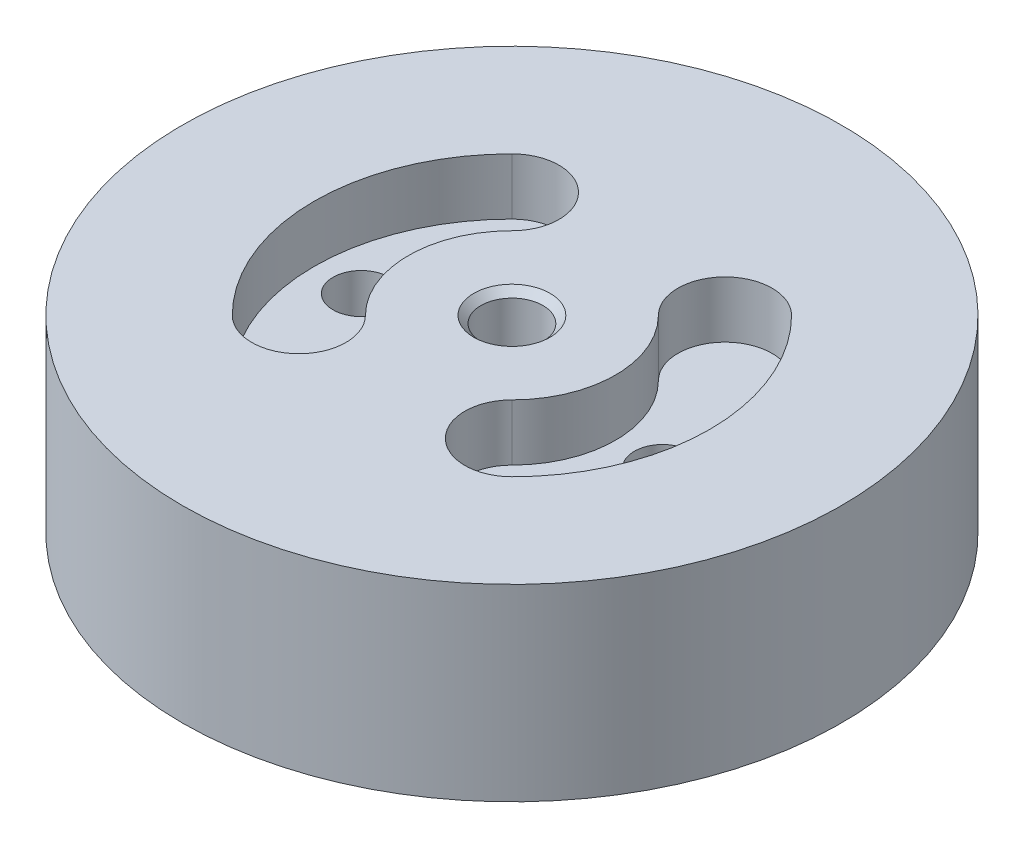
from build123d import *

# Parameters (mm, degrees)
IZIM1_R                     = 17.5
Y_KSEKLIK_EKSTR_ZYON1_DEPTH = 10
KES_EKSTR_ZYON1_DEPTH       = 3
M4_DI_LI_DELIK1_D           = 3.3
M4_DI_LI_DELIK1_DEPTH       = 8
M4_DI_LI_DELIK1_CSINK_D     = 4.05
M4_DI_LI_DELIK1_CSINK_ANGLE = 90
M4_DI_LI_DELIK1_TIP         = 0.991420021
M4_DI_LI_DELIK2_D           = 3.3
M4_DI_LI_DELIK2_CSINK_D     = 4.05
M4_DI_LI_DELIK2_CSINK_ANGLE = 90
IZIM10_R                    = 1.5
KES_EKSTR_ZYON3_DEPTH       = 26.719642299


with BuildPart() as part:
    # Çizim1 → Yükseklik-Ekstrüzyon1 (new body)
    with BuildSketch(Plane(origin=(0, 0, 0), x_dir=(1, 0, 0), z_dir=(0, 1, 0))):
        with Locations(Location((0, 0, 0), (0, 0, 270))):
            Circle(IZIM1_R)
    extrude(amount=Y_KSEKLIK_EKSTR_ZYON1_DEPTH)

    # Çizim2 → Kes-Ekstrüzyon1 (cut)
    with BuildSketch(Plane(origin=(0, 10, 0), x_dir=(1, 0, 0), z_dir=(0, 1, 0))):
        with BuildLine():
            ThreePointArc((-7.424621202, 7.424621202), (-10.5, 0), (-7.424621202, -7.424621202))
            ThreePointArc((-7.424621202, -7.424621202), (-3.889087297, -7.424621202), (-3.889087297, -3.889087297))
            ThreePointArc((-3.889087297, -3.889087297), (-5.5, 0), (-3.889087297, 3.889087297))
            ThreePointArc((-3.889087297, 3.889087297), (-3.889087297, 7.424621202), (-7.424621202, 7.424621202))
        make_face()
        with BuildLine():
            ThreePointArc((7.424621202, 7.424621202), (10.5, 0), (7.424621202, -7.424621202))
            ThreePointArc((7.424621202, -7.424621202), (3.889087297, -7.424621202), (3.889087297, -3.889087297))
            ThreePointArc((3.889087297, -3.889087297), (5.5, 0), (3.889087297, 3.889087297))
            ThreePointArc((3.889087297, 3.889087297), (3.889087297, 7.424621202), (7.424621202, 7.424621202))
        make_face()
    extrude(amount=-KES_EKSTR_ZYON1_DEPTH, mode=Mode.SUBTRACT)

    # M4 Dişli Delik1
    with Locations(Plane(origin=(0, 0, 0), x_dir=(-1, 0, 0), z_dir=(0, -1, 0))):
        with Locations((0, -12.5), (0, 12.5)):
            CounterSinkHole(M4_DI_LI_DELIK1_D / 2, M4_DI_LI_DELIK1_CSINK_D / 2, depth=M4_DI_LI_DELIK1_DEPTH, counter_sink_angle=M4_DI_LI_DELIK1_CSINK_ANGLE)
            with Locations((0, 0, -(M4_DI_LI_DELIK1_DEPTH + M4_DI_LI_DELIK1_TIP / 2))):  # 118° drill point
                Cone(0, M4_DI_LI_DELIK1_D / 2, M4_DI_LI_DELIK1_TIP, mode=Mode.SUBTRACT)

    # M4 Dişli Delik2 (through all)
    with Locations(Plane(origin=(0, 10, 0), x_dir=(1, 0, 0), z_dir=(0, 1, 0))):
        with Locations((0, 0)):
            CounterSinkHole(M4_DI_LI_DELIK2_D / 2, M4_DI_LI_DELIK2_CSINK_D / 2, counter_sink_angle=M4_DI_LI_DELIK2_CSINK_ANGLE)

    # Çizim10 → Kes-Ekstrüzyon3 (cut, through all)
    with BuildSketch(Plane(origin=(0, 7, 0), x_dir=(1, 0, 0), z_dir=(0, 1, 0))):
        with Locations(Location((-8, 0, 0), (0, 0, 270))):
            Circle(IZIM10_R)
        with Locations(Location((8, 0, 0), (0, 0, 270))):
            Circle(IZIM10_R)
    extrude(amount=-KES_EKSTR_ZYON3_DEPTH, mode=Mode.SUBTRACT)


solid = part.part
